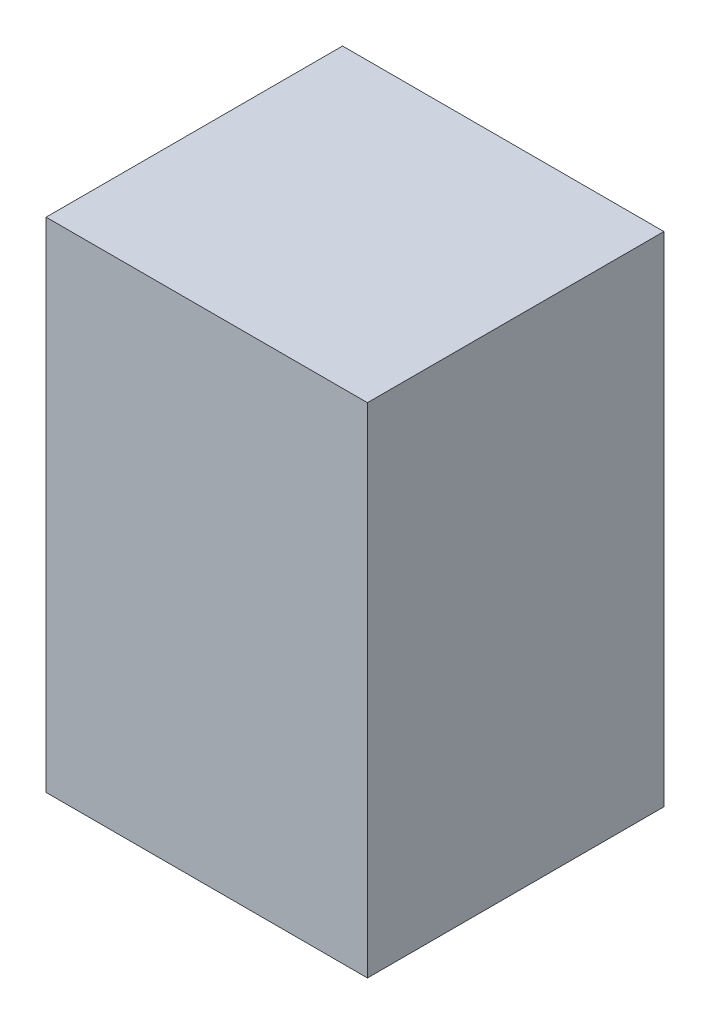
from build123d import *

# Parameters (mm, degrees)
SKETCH1_W           = 1638.3
SKETCH1_H           = 1511.3
BOSS_EXTRUDE1_DEPTH = 2540


with BuildPart() as part:
    # Sketch1 → Boss-Extrude1 (new body)
    with BuildSketch(Plane(origin=(0, 0, 0), x_dir=(1, 0, 0), z_dir=(0, 1, 0))):
        with Locations((819.15, 755.65)):
            Rectangle(SKETCH1_W, SKETCH1_H)
    extrude(amount=BOSS_EXTRUDE1_DEPTH)


solid = part.part
